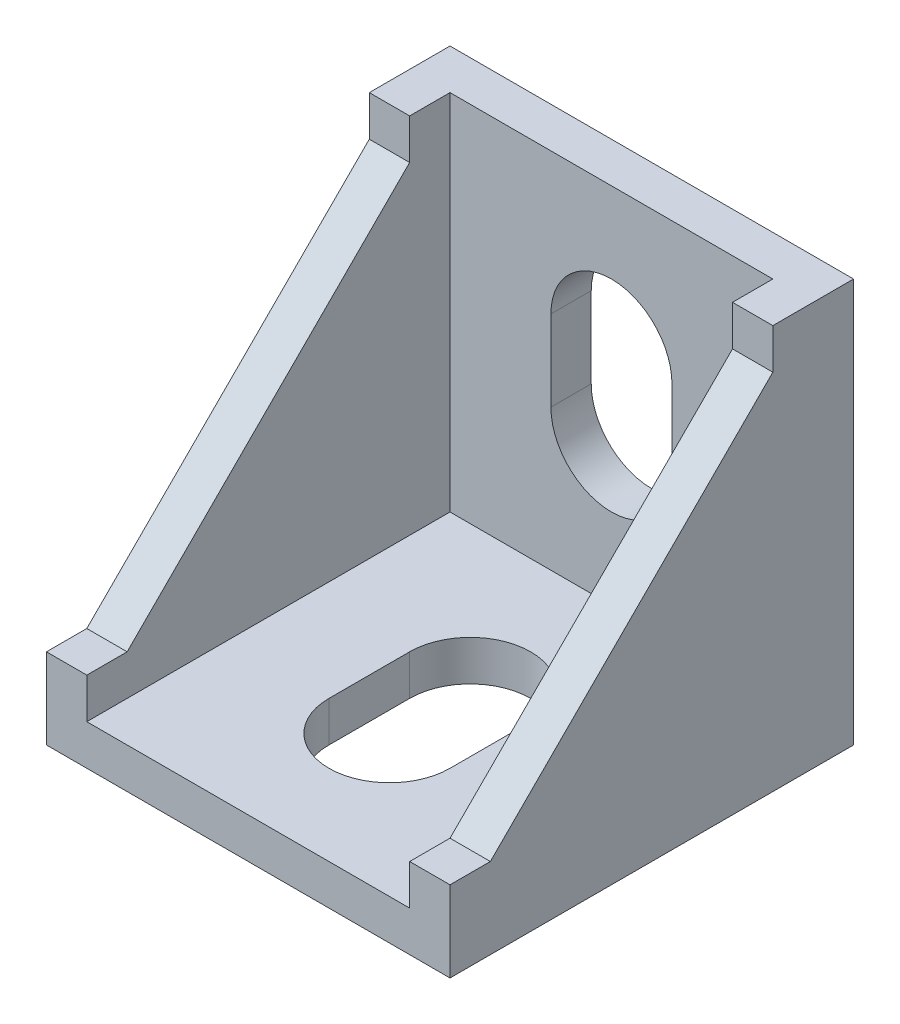
from build123d import *

# Parameters (mm, degrees)
SKETCH2_W               = 20
SKETCH2_H               = 20
BOSS_EXTRUDE1_DEPTH     = 2
SKETCH4_W               = 20
SKETCH4_H               = 20
BOSS_EXTRUDE2_DEPTH     = 2
BOSS_EXTRUDE3_DEPTH     = 2
CUT_EXTRUDE1_DEPTH      = 23.891046285
CUT_EXTRUDE1_DEPTH_BACK = 23.891046285
CUT_EXTRUDE2_DEPTH      = 29.705400189
CUT_EXTRUDE2_DEPTH_BACK = 29.705400189


with BuildPart() as part:
    # Sketch2 → Boss-Extrude1 (new body)
    with BuildSketch(Plane(origin=(0, 0, 0), x_dir=(1, 0, 0), z_dir=(0, 1, 0))):
        Rectangle(SKETCH2_W, SKETCH2_H)
    extrude(amount=BOSS_EXTRUDE1_DEPTH)

    # Sketch4 → Boss-Extrude2 (add)
    with BuildSketch(Plane(origin=(0, 0, -10), x_dir=(-1, 0, 0), z_dir=(0, 0, -1))):
        with Locations((0, 10)):
            Rectangle(SKETCH4_W, SKETCH4_H)
    extrude(amount=-BOSS_EXTRUDE2_DEPTH)

    # Sketch5 → Boss-Extrude3 (add)
    with BuildSketch(Plane.ZY.offset(10)):
        Polygon((-6, 18), (8, 4), (10, 4), (10, 2), (-8, 2), (-8, 20), (-6, 20), align=None)
    boss_extrude3 = extrude(amount=-BOSS_EXTRUDE3_DEPTH)

    # Mirror1: Boss-Extrude3 across plane
    add(boss_extrude3.mirror(Plane(origin=(0, 0, 0), x_dir=(0, 0, 1), z_dir=(1, 0, 0))))

    # Sketch6 → Cut-Extrude1 (cut, two sides: drawn at the far end of the back side and taken through both)
    with BuildSketch(Plane(origin=(0, 2, 0), x_dir=(1, 0, 0), z_dir=(0, 1, 0)).offset(-CUT_EXTRUDE1_DEPTH_BACK)):
        with BuildLine():
            Line((3, 1), (3, -3))
            ThreePointArc((3, -3), (0, -6), (-3, -3))
            Line((-3, -3), (-3, 1))
            ThreePointArc((-3, 1), (0, 4), (3, 1))
        make_face()
    extrude(amount=CUT_EXTRUDE1_DEPTH + CUT_EXTRUDE1_DEPTH_BACK, mode=Mode.SUBTRACT)

    # Sketch7 → Cut-Extrude2 (cut, two sides: drawn at the far end of the back side and taken through both)
    with BuildSketch(Plane.XY.offset(-8).offset(-CUT_EXTRUDE2_DEPTH_BACK)):
        with BuildLine():
            Line((3, 13), (3, 9))
            ThreePointArc((3, 9), (0, 6), (-3, 9))
            Line((-3, 9), (-3, 13))
            ThreePointArc((-3, 13), (0, 16), (3, 13))
        make_face()
    extrude(amount=CUT_EXTRUDE2_DEPTH + CUT_EXTRUDE2_DEPTH_BACK, mode=Mode.SUBTRACT)


solid = part.part
